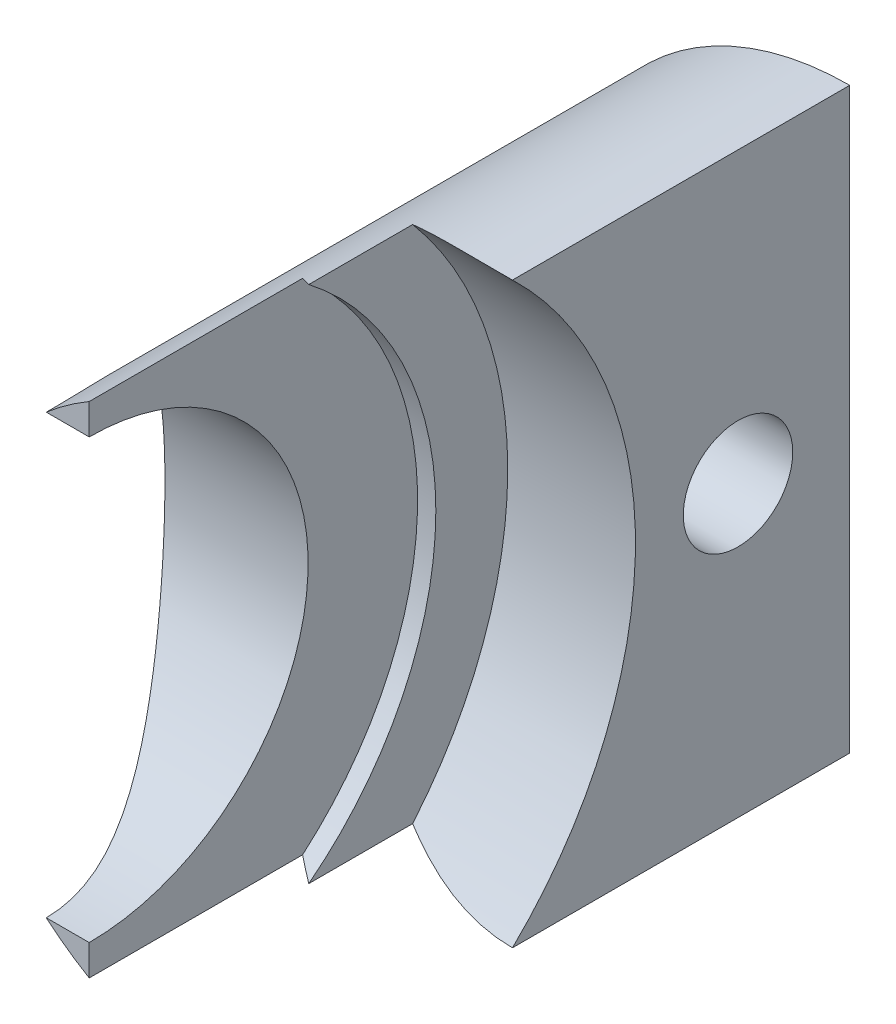
from build123d import *

# Parameters (mm, degrees)
SKETCH1_R               = 7.925
EXTRUDE1_DEPTH          = 16.84375
CUT_EXTRUDE1_DEPTH      = 21.231736556
CUT_EXTRUDE1_DEPTH_BACK = 21.231736556
SKETCH2_W               = 7.925
SKETCH2_H               = 17
SKETCH3_R               = 11
CUT_EXTRUDE2_DEPTH      = 3.5
SKETCH6_R               = 9
CUT_EXTRUDE5_DEPTH      = 4
SKETCH7_R               = 6
SKETCH7_R_2             = 1.5
CUT_EXTRUDE6_DEPTH      = 21.231736717


with BuildPart() as part:
    # Sketch1 → Extrude1 (new body)
    with BuildSketch(Plane.XY):
        Circle(SKETCH1_R)
    extrude(amount=EXTRUDE1_DEPTH)

    # Sketch2 → Cut-Extrude1 (cut, two sides: drawn at the far end of the back side and taken through both)
    with BuildSketch(Plane(origin=(0, 0, 0), x_dir=(1, 0, 0), z_dir=(0, 1, 0)).offset(-CUT_EXTRUDE1_DEPTH_BACK)):
        with Locations((3.9625, -8.5)):
            Rectangle(SKETCH2_W, SKETCH2_H)
    extrude(amount=CUT_EXTRUDE1_DEPTH + CUT_EXTRUDE1_DEPTH_BACK, mode=Mode.SUBTRACT)

    # Sketch3 → Cut-Extrude2 (cut)
    with BuildSketch(Plane(origin=(0, 0, 0), x_dir=(0, 0, -1), z_dir=(1, 0, 0))):
        with Locations((-16.873106172, 0)):
            Circle(SKETCH3_R)
    extrude(amount=-CUT_EXTRUDE2_DEPTH, mode=Mode.SUBTRACT)

    # Sketch6 → Cut-Extrude5 (cut)
    with BuildSketch(Plane(origin=(0, 0, 0), x_dir=(0, 0, -1), z_dir=(1, 0, 0))):
        with Locations((-16.84375, 0)):
            Circle(SKETCH6_R)
    extrude(amount=-CUT_EXTRUDE5_DEPTH, mode=Mode.SUBTRACT)

    # Sketch7 → Cut-Extrude6 (cut, through all)
    with BuildSketch(Plane(origin=(0, 0, 0), x_dir=(0, 0, -1), z_dir=(1, 0, 0))):
        with Locations((-16.84375, 0)):
            Circle(SKETCH7_R)
        with Locations((-3.0625, 0)):
            Circle(SKETCH7_R_2)
    extrude(amount=-CUT_EXTRUDE6_DEPTH, mode=Mode.SUBTRACT)


solid = part.part
